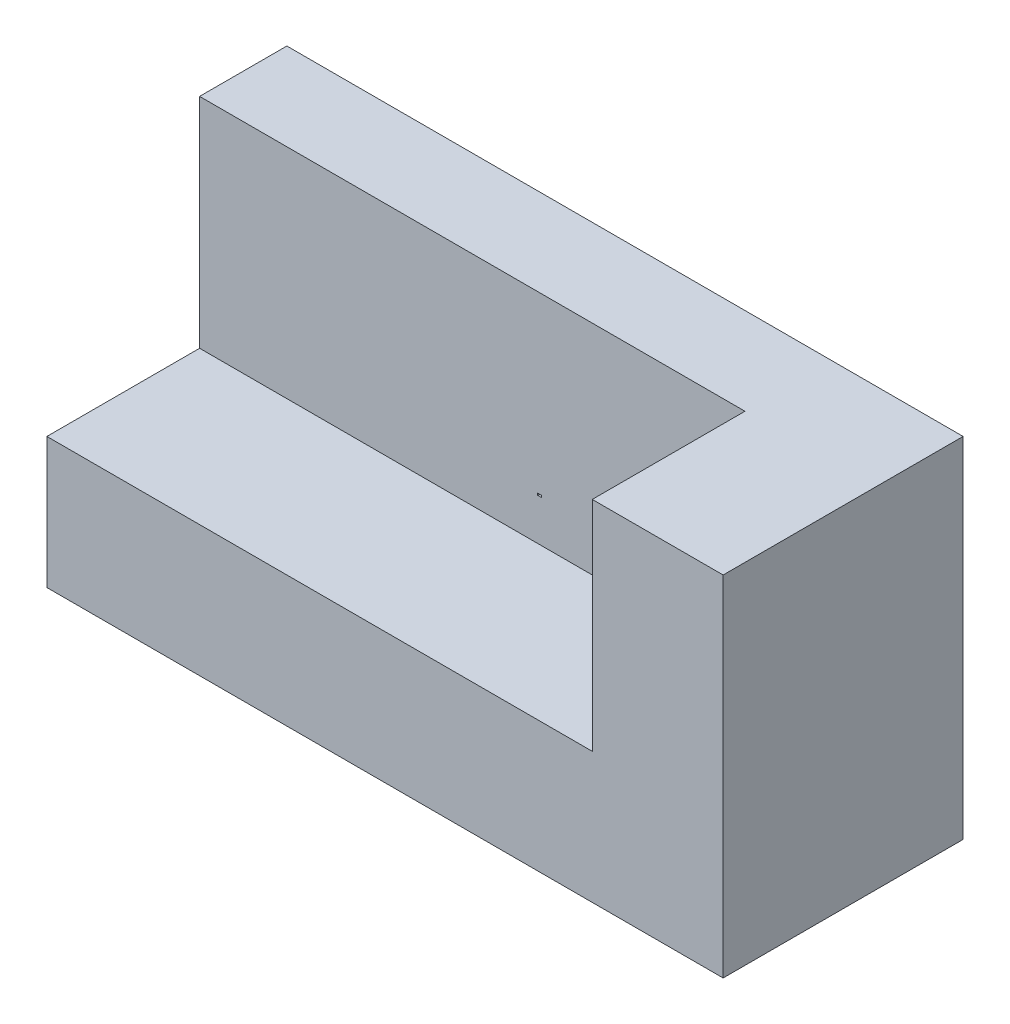
from build123d import *

# Parameters (mm, degrees)
ESBO_O1_W                  = 62
ESBO_O1_H                  = 32
ESBO_O1_W_2                = 0.346266541
ESBO_O1_H_2                = 0.178718215
RESSALTO_EXTRUS_O1_DEPTH   = 22
CORTE_EXTRUS_O4_DEPTH      = 42.243181255
CORTE_EXTRUS_O4_DEPTH_BACK = 14
ESBO_O2_W                  = 50
ESBO_O2_H                  = 20


with BuildPart() as part:
    # Esboço1 → Ressalto-extrusão1 (new body)
    with BuildSketch(Plane.XY):
        Rectangle(ESBO_O1_W, ESBO_O1_H)
        with Locations((0.173133271, -0.089359108)):
            Rectangle(ESBO_O1_W_2, ESBO_O1_H_2, mode=Mode.SUBTRACT)
    extrude(amount=RESSALTO_EXTRUS_O1_DEPTH)

    # Esboço2 → Corte-extrusão4 (cut, two sides: drawn at the far end of the back side and taken through both)
    with BuildSketch(Plane.XY.offset(22).offset(-CORTE_EXTRUS_O4_DEPTH_BACK)):
        with Locations((-6, 6)):
            Rectangle(ESBO_O2_W, ESBO_O2_H)
    extrude(amount=CORTE_EXTRUS_O4_DEPTH + CORTE_EXTRUS_O4_DEPTH_BACK, mode=Mode.SUBTRACT)


solid = part.part
